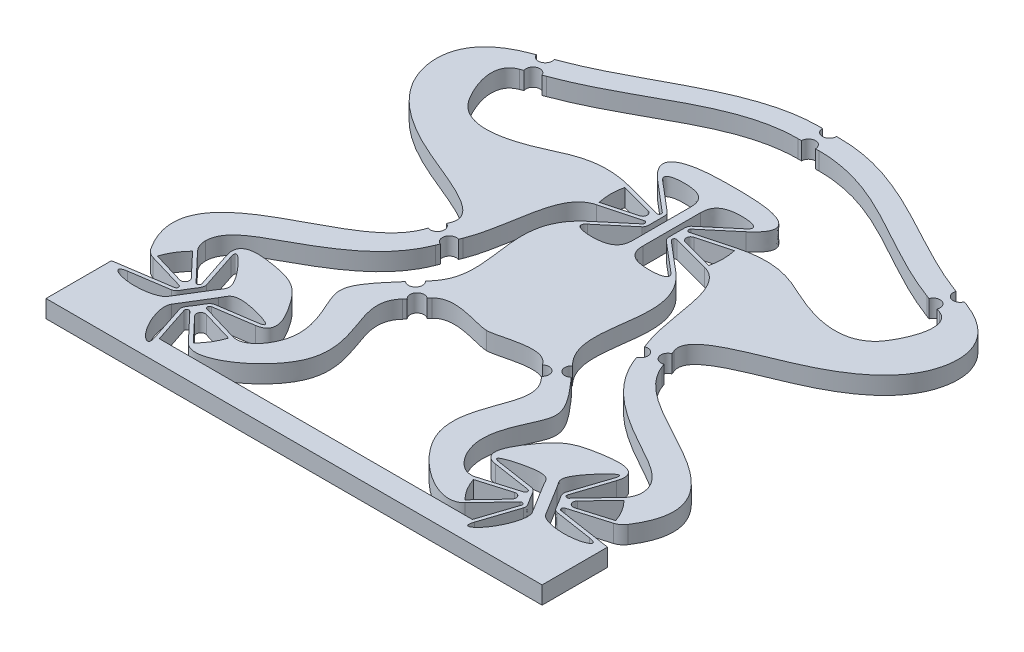
from build123d import *

# Parameters (mm, degrees)
BOSS_EXTRUDE1_DEPTH = 10


with BuildPart() as part:
    # Sketch4 → Boss-Extrude1 (new body)
    with BuildSketch(Plane(origin=(0, 0, 0), x_dir=(1, 0, 0), z_dir=(0, 1, 0))):
        with BuildLine():
            Line((-39.527863931, 58.609903268), (-38.194530597, 60.100615253))
            ThreePointArc((-38.194530597, 60.100615253), (-38.509288015, 65.748705992), (-32.861197264, 66.063463193))
            Line((-32.861197264, 66.063463193), (-31.527863931, 67.554175178))
            add(Edge.make_bspline(
                [(-31.527863931, 67.554175178), (-24.542372455, 75.364192076), (-6.551305031, 67.082039325), (0, 67.082039325)],
                knots=[0, 0, 0, 0, 1, 1, 1, 1], degree=3))
            Line((0, 67.082039325), (0, 207.924200068))
            add(Edge.make_bspline(
                [(-25.057979887, 189.453748972), (-48.620222984, 209.368364736), (-5.076650603, 207.924200068), (0, 207.924200068)],
                knots=[0, 0, 0, 0, 1, 1, 1, 1], degree=3))
            Line((-25.057979887, 189.453748972), (-8.230472127, 175.231276606))
            ThreePointArc((-8.230472127, 175.231276606), (-7.929631457, 173.69743017), (-9.360888398, 173.069183747))
            Line((-9.360888398, 173.069183747), (-30.642927147, 178.771688843))
            add(Edge.make_bspline(
                [(-119.4438851, 205.142202368), (-130.857720115, 200.877780111), (-121.687517225, 178.517310642), (-107.944535651, 163.298081936), (-83.140148617, 165.535890376), (-51.093834974, 184.25149308), (-30.642927147, 178.771688843)],
                knots=[0, 0, 0, 0, 0.228027148, 0.303298765, 0.75271617, 1, 1, 1, 1], degree=3))
            Line((-119.4438851, 205.142202368), (-117.570377314, 205.842179921))
            ThreePointArc((-117.570377314, 205.842179921), (-115.223316728, 210.98915028), (-110.076346168, 208.642090132))
            Line((-110.076346168, 208.642090132), (-108.202838382, 209.342067685))
            add(Edge.make_bspline(
                [(-108.202838382, 209.342067685), (-69.239563588, 223.899475954), (-42.68582532, 250.173769149), (-6, 250.173769149)],
                knots=[0, 0, 0, 0, 1, 1, 1, 1], degree=3))
            Line((-6, 250.173769149), (-4, 250.173769149))
            ThreePointArc((-4, 250.173769149), (-2.828427125, 253.002196274), (0, 254.173769149))
            Line((0, 254.173769149), (0, 258.173769149))
            ThreePointArc((0, 258.173769149), (-2.828427125, 259.345342024), (-4, 262.173769149))
            Line((-4, 262.173769149), (-6, 262.173769149))
            add(Edge.make_bspline(
                [(-112.402703461, 220.583113766), (-76.730376789, 233.910962259), (-44.089424314, 262.173769149), (-6, 262.173769149)],
                knots=[0, 0, 0, 0, 1, 1, 1, 1], degree=3))
            Line((-112.402703461, 220.583113766), (-114.276211247, 219.883136213))
            ThreePointArc((-114.276211247, 219.883136213), (-116.623271833, 214.736165853), (-121.770242393, 217.083226002))
            Line((-121.770242393, 217.083226002), (-123.643750179, 216.383248449))
            add(Edge.make_bspline(
                [(-123.643750179, 216.383248449), (-146.450625439, 207.86217325), (-155.131512498, 174.125749926), (-116.986794557, 138.227232781), (-58.429591821, 122.992479383), (-63.407426979, 110.240571436)],
                knots=[0, 0, 0, 0, 0.283698631, 0.638823971, 1, 1, 1, 1], degree=3))
            Line((-63.407426979, 110.240571436), (-64.134699707, 108.377489479))
            ThreePointArc((-64.134699707, 108.377489479), (-61.863081957, 103.196780387), (-67.043790616, 100.925161649))
            Line((-67.043790616, 100.925161649), (-67.771063343, 99.062079691))
            add(Edge.make_bspline(
                [(-135.776318782, 11.796236207), (-154.286015015, 40.155187688), (-110.233485187, 67.576025287), (-73.438429993, 84.543772932), (-67.771063343, 99.062079691)],
                knots=[0, 0, 0, 0, 0.537437585, 1, 1, 1, 1], degree=3))
            ThreePointArc((-135.776318782, 11.796236207), (-133.676604194, 9.560846686), (-130.935350393, 8.185602974))
            Line((-130.935350393, 8.185602974), (-109.817210667, 1.903253721))
            ThreePointArc((-109.817210667, 1.903253721), (-108.926622874, 0.618713576), (-109.985909075, -0.530678761))
            Line((-109.985909075, -0.530678761), (-131.768823633, -3.839511032))
            Line((-131.768823633, -3.839511032), (-141.11660436, -5.259442164))
            Line((-141.11660436, -5.259442164), (-141.11660436, -42.48786461))
            Line((-141.11660436, -42.48786461), (0, -42.48786461))
            Line((0, -42.48786461), (0, -30.074978836))
            Line((0, -30.074978836), (-89.068593502, -30.074978836))
            Line((-89.068593502, -30.074978836), (-95.960714088, -9.147905188))
            ThreePointArc((-95.960714088, -9.147905188), (-95.414077585, -7.683535517), (-93.865721734, -7.897507845))
            Line((-93.865721734, -7.897507845), (-78.718050877, -23.897251757))
            add(Edge.make_bspline(
                [(-78.718050877, -23.897251757), (-70.017728448, -33.086976839), (-29.224325841, -4.813321743), (-37.357549167, 29.2886508), (-46.748315314, 50.537193208), (-39.527863931, 58.609903268)],
                knots=[0, 0, 0, 0, 0.440379294, 0.746389866, 1, 1, 1, 1], degree=3))
        make_face()
        with BuildLine():
            ThreePointArc((-109.788802349, 8.848536819), (-109.474177953, 5.821033983), (-112.317090346, 4.73355476))
            Line((-112.317090346, 4.73355476), (-130.363579274, 10.102131145))
            ThreePointArc((-130.363579274, 10.102131145), (-127.264914617, 16.751848583), (-122.733232017, 22.521104815))
            Line((-122.733232017, 22.521104815), (-109.788802349, 8.848536819))
        make_face(mode=Mode.SUBTRACT)
        with BuildLine():
            Line((-102.639874546, -9.645261136), (-92.412147212, 7.001147235))
            add(Edge.make_bspline(
                [(-68.5330772, 5.816594321), (-60.831367982, 6.98648662), (-90.759953919, 15.930223966), (-90.269939683, 10.487753808), (-92.412147212, 7.001147235)],
                knots=[0, 0, 0, 0, 0.378704574, 1, 1, 1, 1], degree=3))
            Line((-68.5330772, 5.816594321), (-90.319414437, 2.507242144))
            add(Edge.make_bspline(
                [(-90.319414437, 2.507242144), (-91.202729242, 2.373066319), (-92.656305437, 1.026209798), (-94.991858829, -3.268320021), (-96.260186949, -4.99975168), (-98.352764716, -8.278355096), (-97.861916152, -9.768756188)],
                knots=[0, 0, 0, 0, 0.184332296, 0.256485144, 0.721528486, 1, 1, 1, 1], degree=3))
            Line((-97.861916152, -9.768756188), (-90.968712629, -30.69911804))
            add(Edge.make_bspline(
                [(-90.968712629, -30.69911804), (-89.081673, -36.428881006), (-97.849885779, -32.623193487), (-105.189753525, -13.79538417), (-102.639874546, -9.645261136)],
                knots=[0, 0, 0, 0, 0.364886235, 1, 1, 1, 1], degree=3))
        make_face(mode=Mode.SUBTRACT)
        with BuildLine():
            ThreePointArc((-90.211197651, -8.848536819), (-90.525822047, -5.821033983), (-87.682909654, -4.73355476))
            Line((-87.682909654, -4.73355476), (-69.636420726, -10.102131145))
            ThreePointArc((-69.636420726, -10.102131145), (-72.735085383, -16.751848583), (-77.266767983, -22.521104815))
            Line((-77.266767983, -22.521104815), (-90.211197651, -8.848536819))
        make_face(mode=Mode.SUBTRACT)
        with BuildLine():
            Line((-102.138083848, 9.768756188), (-109.031287371, 30.69911804))
            add(Edge.make_bspline(
                [(-109.031287371, 30.69911804), (-111.468110438, 38.098230569), (-89.964817825, 15.441684037), (-95.041299741, 13.41932731), (-97.18350727, 9.932720737)],
                knots=[0, 0, 0, 0, 0.378704574, 1, 1, 1, 1], degree=3))
            Line((-97.18350727, 9.932720737), (-107.411234604, -6.713687634))
            add(Edge.make_bspline(
                [(-131.4669228, -5.816594321), (-137.431012153, -6.72254156), (-130.07368546, -12.824554078), (-109.961113583, -10.863810668), (-107.411234604, -6.713687634)],
                knots=[0, 0, 0, 0, 0.364886235, 1, 1, 1, 1], degree=3))
            Line((-131.4669228, -5.816594321), (-109.680585563, -2.507242144))
            add(Edge.make_bspline(
                [(-102.138083848, 9.768756188), (-101.858602783, 8.920146425), (-102.403208562, 7.014808977), (-105.178762797, 2.990620277), (-106.150149535, 1.076744728), (-108.129232507, -2.271591077), (-109.680585563, -2.507242144)],
                knots=[0, 0, 0, 0, 0.184332296, 0.256485144, 0.721528486, 1, 1, 1, 1], degree=3))
        make_face(mode=Mode.SUBTRACT)
        with BuildLine():
            ThreePointArc((-41.805469403, 74.063463397), (-41.490711985, 68.415372658), (-47.138802736, 68.100615457))
            Line((-47.138802736, 68.100615457), (-48.472136069, 66.609903472))
            add(Edge.make_bspline(
                [(-48.472136069, 66.609903472), (-62.371589758, 51.069841823), (-63.592505105, 41.064783358), (-44.628679982, 10.813282957), (-61.912505942, -10.313265021), (-69.064649607, -8.185602974)],
                knots=[0, 0, 0, 0, 0.353429586, 0.749579171, 1, 1, 1, 1], degree=3))
            Line((-69.064649607, -8.185602974), (-90.182789333, -1.903253721))
            ThreePointArc((-90.182789333, -1.903253721), (-91.073377126, -0.618713576), (-90.014090925, 0.530678761))
            Line((-90.014090925, 0.530678761), (-68.231176367, 3.839511032))
            add(Edge.make_bspline(
                [(-110.931406498, 30.074978836), (-114.670716411, 41.42893194), (-83.276257122, 38.258995012), (-72.673663435, 32.493946835), (-57.481258156, 5.472427334), (-68.231176367, 3.839511032)],
                knots=[0, 0, 0, 0, 0.279767539, 0.720232461, 1, 1, 1, 1], degree=3))
            Line((-110.931406498, 30.074978836), (-104.039285912, 9.147905188))
            ThreePointArc((-104.039285912, 9.147905188), (-104.585922415, 7.683535517), (-106.134278266, 7.897507845))
            Line((-106.134278266, 7.897507845), (-121.281949123, 23.897251757))
            ThreePointArc((-121.281949123, 23.897251757), (-123.446649445, 27.285388096), (-124.204053522, 31.234025127))
            add(Edge.make_bspline(
                [(-124.204053522, 31.234025127), (-124.204053522, 41.522682623), (-89.896007064, 59.068812064), (-64.070931131, 75.540852042), (-56.592573021, 94.698443883)],
                knots=[0, 0, 0, 0, 0.33550184, 1, 1, 1, 1], degree=3))
            Line((-56.592573021, 94.698443883), (-55.865300293, 96.561525841))
            ThreePointArc((-55.865300293, 96.561525841), (-58.136918043, 101.742234932), (-52.956209384, 104.01385367))
            Line((-52.956209384, 104.01385367), (-52.228936657, 105.876935628))
            add(Edge.make_bspline(
                [(-30.642927147, 160.331405126), (-47.758609648, 155.745271822), (-43.949660773, 127.086268717), (-52.228936657, 105.876935628)],
                knots=[0, 0, 0, 0, 1, 1, 1, 1], degree=3))
            Line((-30.642927147, 160.331405126), (-9.360888398, 166.033910222))
            ThreePointArc((-9.360888398, 166.033910222), (-7.929631457, 165.405663799), (-8.230472127, 163.871817363))
            Line((-8.230472127, 163.871817363), (-25.057979887, 149.649344997))
            add(Edge.make_bspline(
                [(-25.057979887, 149.649344997), (-51.058164145, 127.67420124), (-22.399166064, 95.760370126), (-40.472136069, 75.554175382)],
                knots=[0, 0, 0, 0, 1, 1, 1, 1], degree=3))
            Line((-40.472136069, 75.554175382), (-41.805469403, 74.063463397))
        make_face(mode=Mode.SUBTRACT)
        with BuildLine():
            ThreePointArc((-12.972506538, 171.96636155), (-11.119554151, 169.551546985), (-12.972506538, 167.136732419))
            Line((-12.972506538, 167.136732419), (-31.15905524, 162.263661381))
            ThreePointArc((-31.15905524, 162.263661381), (-32, 169.551546985), (-31.15905524, 176.839432588))
            Line((-31.15905524, 176.839432588), (-12.972506538, 171.96636155))
        make_face(mode=Mode.SUBTRACT)
        with BuildLine():
            add(Edge.make_bspline(
                [(-23.765758002, 190.980236785), (-28.8424159, 195.270986651), (-7.744385983, 197.788042743), (-2.8, 191.70124114), (-2.8, 185.989992883)],
                knots=[0, 0, 0, 0, 0.455542439, 1, 1, 1, 1], degree=3))
            Line((-2.8, 185.989992883), (-2.8, 153.113101086))
            add(Edge.make_bspline(
                [(-23.765758002, 148.122857184), (-28.8424159, 143.832107319), (-7.744385983, 141.315051226), (-2.8, 147.401852829), (-2.8, 153.113101086)],
                knots=[0, 0, 0, 0, 0.455542439, 1, 1, 1, 1], degree=3))
            Line((-23.765758002, 148.122857184), (-6.935606189, 162.347564281))
            add(Edge.make_bspline(
                [(-6.935606189, 176.755529688), (-6.071483777, 176.02518047), (-5.767037437, 174.384848409), (-5.853381288, 170.377102519), (-5.770232704, 167.051006273), (-5.819389395, 163.290981615), (-6.935606189, 162.347564281)],
                knots=[0, 0, 0, 0, 0.233430382, 0.307493673, 0.740632909, 1, 1, 1, 1], degree=3))
            Line((-6.935606189, 176.755529688), (-23.765758002, 190.980236785))
        make_face(mode=Mode.SUBTRACT)
    extrude(amount=BOSS_EXTRUDE1_DEPTH)

    # Mirror1: part across plane


with BuildPart() as part_1:
    add(part.part)
    add(part.part.mirror(Plane(origin=(0, 10, 0), x_dir=(0, 0, 1), z_dir=(1, 0, 0))))


solid = part_1.part
